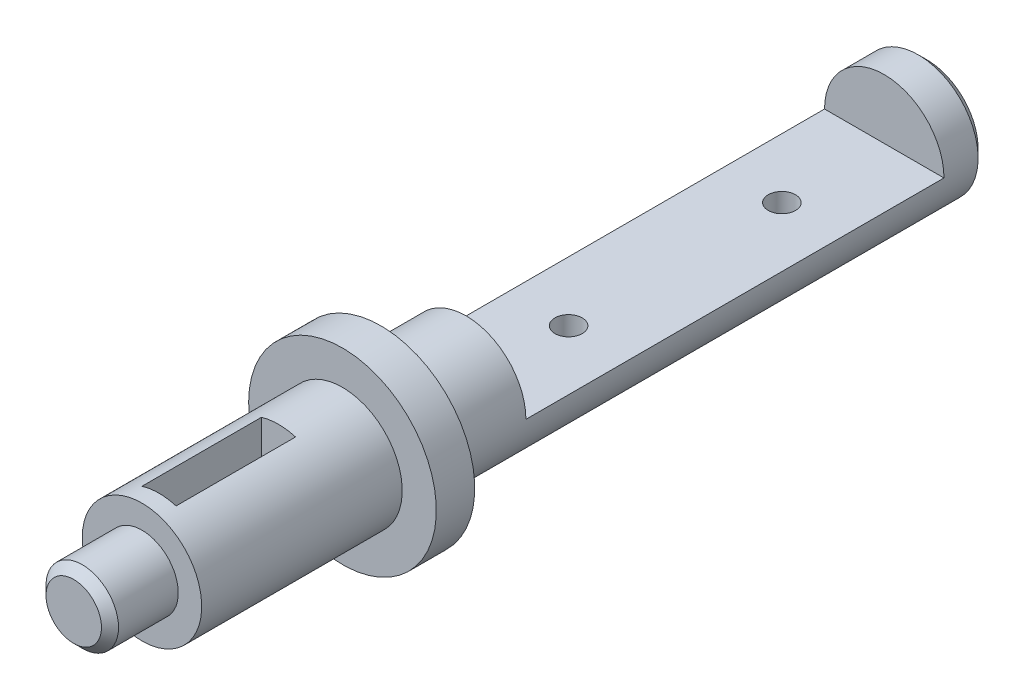
from build123d import *

# Parameters (mm, degrees)
SKETCH1_R               = 4.25
BOSS_EXTRUDE1_DEPTH     = 8
CHAMFER1_SIZE           = 1
SKETCH2_R               = 7
BOSS_EXTRUDE2_DEPTH     = 23.5
SKETCH4_R               = 11
BOSS_EXTRUDE3_DEPTH     = 4.5
SKETCH5_R               = 7
BOSS_EXTRUDE4_DEPTH     = 64
CUT_EXTRUDE2_DEPTH      = 94.305948363
CUT_EXTRUDE2_DEPTH_BACK = 94.305948363
SKETCH6_W               = 49
SKETCH6_H               = 7
CUT_EXTRUDE3_REACH      = 95.306
CUT_EXTRUDE3_END_RADIUS = 7
SKETCH7_R               = 1.6
CHAMFER2_SIZE           = 1
SKETCH8_W               = 4
SKETCH8_H               = 14
CUT_EXTRUDE4_DEPTH      = 10


with BuildPart() as part:
    # Sketch1 → Boss-Extrude1 (new body)
    with BuildSketch(Plane.XY):
        Circle(SKETCH1_R)
    extrude(amount=BOSS_EXTRUDE1_DEPTH)

    # Chamfer1
    chamfer1_edges = [part.edges().sort_by_distance(p)[0] for p in [
        (-4.25, 0, 8),
    ]]
    chamfer(chamfer1_edges, length=CHAMFER1_SIZE)

    # Sketch2 → Boss-Extrude2 (add)
    with BuildSketch(Plane(origin=(0, 0, 0), x_dir=(-1, 0, 0), z_dir=(0, 0, -1))):
        Circle(SKETCH2_R)
    extrude(amount=BOSS_EXTRUDE2_DEPTH)

    # Sketch4 → Boss-Extrude3 (add)
    with BuildSketch(Plane(origin=(0, 0, -23.5), x_dir=(-1, 0, 0), z_dir=(0, 0, -1))):
        Circle(SKETCH4_R)
    extrude(amount=BOSS_EXTRUDE3_DEPTH)

    # Sketch5 → Boss-Extrude4 (add)
    with BuildSketch(Plane(origin=(0, 0, -28), x_dir=(-1, 0, 0), z_dir=(0, 0, -1))):
        Circle(SKETCH5_R)
    extrude(amount=BOSS_EXTRUDE4_DEPTH)

    # Sketch6 → Cut-Extrude2 (cut, two sides: drawn at the far end of the back side and taken through both)
    with BuildSketch(Plane(origin=(0, 0, 0), x_dir=(0, 0, -1), z_dir=(1, 0, 0)).offset(-CUT_EXTRUDE2_DEPTH_BACK)):
        with Locations((62.5, 3.5)):
            Rectangle(SKETCH6_W, SKETCH6_H)
    extrude(amount=CUT_EXTRUDE2_DEPTH + CUT_EXTRUDE2_DEPTH_BACK, mode=Mode.SUBTRACT)

    # Cut-Extrude3: up to this cylinder (the profile starts inside it)
    cut_extrude3_end = Plane(origin=(0, 0, -62.5), z_dir=(0, 0, 1)) * Cylinder(CUT_EXTRUDE3_END_RADIUS, 230.612, mode=Mode.PRIVATE)
    # Sketch7 → Cut-Extrude3 (cut, up to the surface)
    with BuildSketch(Plane(origin=(0, 0, 0), x_dir=(1, 0, 0), z_dir=(0, 1, 0)), mode=Mode.PRIVATE) as cut_extrude3_sk1:
        with Locations(Location((0, 75, 0), (0, 0, 270))):
            Circle(SKETCH7_R)
    cut_extrude3_tool1 = extrude(cut_extrude3_sk1.sketch, amount=-CUT_EXTRUDE3_REACH, mode=Mode.PRIVATE) & cut_extrude3_end
    add(cut_extrude3_tool1.solids().sort_by_distance((0, 0, -75))[0], mode=Mode.SUBTRACT)
    # Sketch7 → Cut-Extrude3 (cut, up to the surface)
    with BuildSketch(Plane(origin=(0, 0, 0), x_dir=(1, 0, 0), z_dir=(0, 1, 0)), mode=Mode.PRIVATE) as cut_extrude3_sk2:
        with Locations(Location((0, 50, 0), (0, 0, 270))):
            Circle(SKETCH7_R)
    cut_extrude3_tool2 = extrude(cut_extrude3_sk2.sketch, amount=-CUT_EXTRUDE3_REACH, mode=Mode.PRIVATE) & cut_extrude3_end
    add(cut_extrude3_tool2.solids().sort_by_distance((0, 0, -50))[0], mode=Mode.SUBTRACT)

    # Chamfer2
    chamfer2_edges = [part.edges().sort_by_distance(p)[0] for p in [
        (7, 0, -92),
    ]]
    chamfer(chamfer2_edges, length=CHAMFER2_SIZE)

    # Sketch8 → Cut-Extrude4 (cut)
    with BuildSketch(Plane(origin=(0, 0, 0), x_dir=(1, 0, 0), z_dir=(0, 1, 0))):
        with Locations((0, 9)):
            Rectangle(SKETCH8_W, SKETCH8_H)
    extrude(amount=CUT_EXTRUDE4_DEPTH, mode=Mode.SUBTRACT)


solid = part.part
